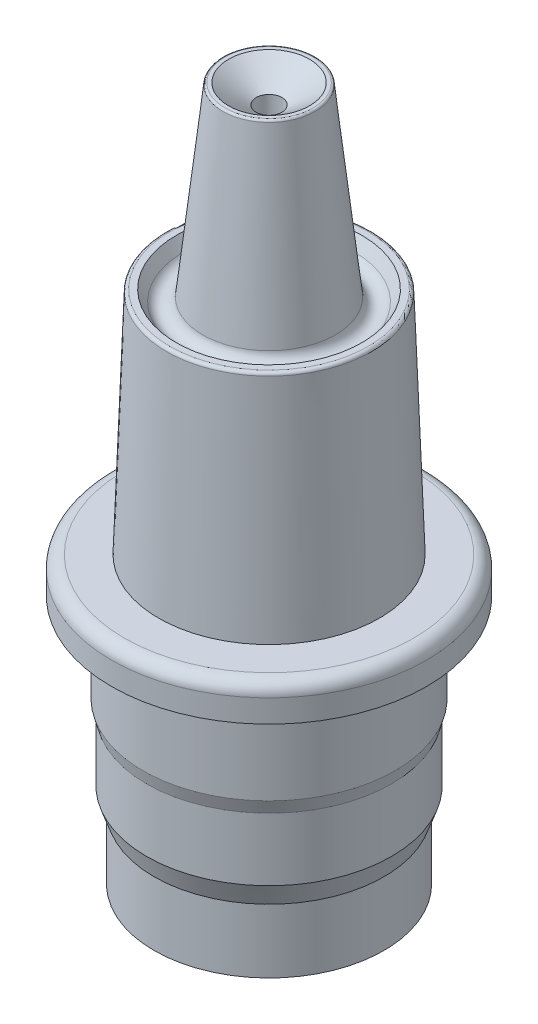
from build123d import *

# Parameters (mm, degrees)
FILLET3_R                = 0.6
EXTRUS_O1_DEPTH          = 0.3
FILETE1_R                = 0.2
PADR_OCIRCULAR1_COUNT    = 4
FILETE2_R                = 0.1
RESSALTO_EXTRUS_O1_DEPTH = 0.3
PADR_OCIRCULAR2_COUNT    = 8


with BuildPart() as part:
    # Sketch1 → Base-Revolve (revolve)
    with BuildSketch(Plane.XY, mode=Mode.PRIVATE) as base_revolve_sk:
        with BuildLine():
            Line((4.5, 0), (5.4, 0))
            Line((5.4, 0), (5.4, 3))
            Line((5.4, 3), (5.75, 4))
            Line((5.75, 4), (5.75, 6.95))
            Line((5.75, 6.95), (5.915, 7.57))
            Line((5.915, 7.57), (5.915, 11.74))
            Line((5.915, 11.74), (7.4, 11.74))
            Line((7.4, 11.74), (7.4, 13.41))
            Line((7.4, 13.41), (5.185, 13.41))
            Line((5.185, 13.41), (4.812910997, 24.065234925))
            ThreePointArc((4.812910997, 24.065234925), (4.767201129, 24.16790097), (4.663002373, 24.21))
            Line((4.663002373, 24.21), (4.365, 24.21))
            Line((4.365, 24.21), (4.034261245, 23.688507274))
            ThreePointArc((4.034261245, 23.688507274), (3.49901294, 23.469237129), (3.115, 23.901792566))
            Line((3.115, 23.901792566), (2.16, 32.61))
            Line((2.16, 32.61), (1.9, 32.61))
            Line((1.9, 32.61), (0.601613595, 31.700860052))
            Line((0.601613595, 31.700860052), (0.539050939, 28.348134301))
            ThreePointArc((0.539050939, 28.348134301), (0.509116293, 28.278632746), (0.439068345, 28.25))
            Line((0.439068345, 28.25), (0, 28.25))
            Line((0, 28.25), (0, 27.95))
            Line((0, 27.95), (0.635, 27.95))
            ThreePointArc((0.635, 27.95), (0.705710678, 27.920710678), (0.735, 27.85))
            Line((0.735, 27.85), (0.735, 25.497341423))
            Line((0.735, 25.497341423), (1.058192136, 25.497341423))
            Line((1.058192136, 25.497341423), (1.25, 30.99))
            Line((1.25, 30.99), (1.635876633, 30.99))
            Line((1.635876633, 30.99), (2.403238417, 23.992779487))
            ThreePointArc((2.403238417, 23.992779487), (2.893119442, 23.039321167), (3.89429889, 22.656299105))
            Line((3.89429889, 22.656299105), (3.911279221, 22.656299105))
            ThreePointArc((3.911279221, 22.656299105), (4.016306631, 22.613393657), (4.061250733, 22.509222346))
            Line((4.061250733, 22.509222346), (4.5, 0))
        make_face()
    revolve(base_revolve_sk.sketch.rotate(Axis((0, -0.8, 0), (0, 1, 0)), 90), axis=Axis((0, -0.8, 0), (0, 1, 0)))

    # Fillet3
    fillet3_edges = [part.edges().sort_by_distance(p)[0] for p in [
        (0, 13.41, 7.4),
    ]]
    fillet(fillet3_edges, radius=FILLET3_R)

    # Esboço1 → Extrusão1 (add, symmetric)
    with BuildSketch(Plane(origin=(0, 0, 0), x_dir=(0, 0, -1), z_dir=(1, 0, 0))):
        Polygon((-1.635876633, 30.99), (-1, 30.99), (-0.808192136, 25.497341423), (-2.238238139, 25.497341423), align=None)
        Polygon((1, 30.99), (0.808192136, 25.497341423), (2.238238139, 25.497341423), (1.635876633, 30.99), align=None)
    extrus_o1 = extrude(amount=EXTRUS_O1_DEPTH, both=True)

    # Filete1
    filete1_edges = [part.edges().sort_by_distance(p)[0] for p in [
        (1.635876633, 30.99, 0),
        (-1.635876633, 30.99, 0),
    ]]
    fillet(filete1_edges, radius=FILETE1_R)

    # PadrãoCircular1: Extrusão1 ×4 about axis
    padr_ocircular1_axis = Axis((0, 22.509222346, 0), (0, -1, 0))
    for i in range(1, PADR_OCIRCULAR1_COUNT):
        add(extrus_o1.rotate(padr_ocircular1_axis, i * 360 / PADR_OCIRCULAR1_COUNT))

    # Filete2
    filete2_edges = [part.edges().sort_by_distance(p)[0] for p in [
        (0, 32.61, 2.16),
    ]]
    fillet(filete2_edges, radius=FILETE2_R)

    # Esboço5 → Ressalto-extrusão1 (add, symmetric)
    with BuildSketch(Plane(origin=(0, 0, 0), x_dir=(0, 0, -1), z_dir=(1, 0, 0))):
        with BuildLine():
            Line((-2.484759959, 23.64326889), (-4.12709939, 19.130978387))
            Line((-4.12709939, 19.130978387), (-4.061250733, 22.509222346))
            ThreePointArc((-4.061250733, 22.509222346), (-4.010136144, 22.619495177), (-3.89429889, 22.656299105))
            ThreePointArc((-3.89429889, 22.656299105), (-3.033934236, 22.927571038), (-2.484759959, 23.64326889))
        make_face()
    ressalto_extrus_o1 = extrude(amount=RESSALTO_EXTRUS_O1_DEPTH, both=True)

    # PadrãoCircular2: Ressalto-extrusão1 ×8 about axis
    padr_ocircular2_axis = Axis((0, 0, 0), (0, 1, 0))
    for i in range(1, PADR_OCIRCULAR2_COUNT):
        add(ressalto_extrus_o1.rotate(padr_ocircular2_axis, i * 360 / PADR_OCIRCULAR2_COUNT))


solid = part.part
